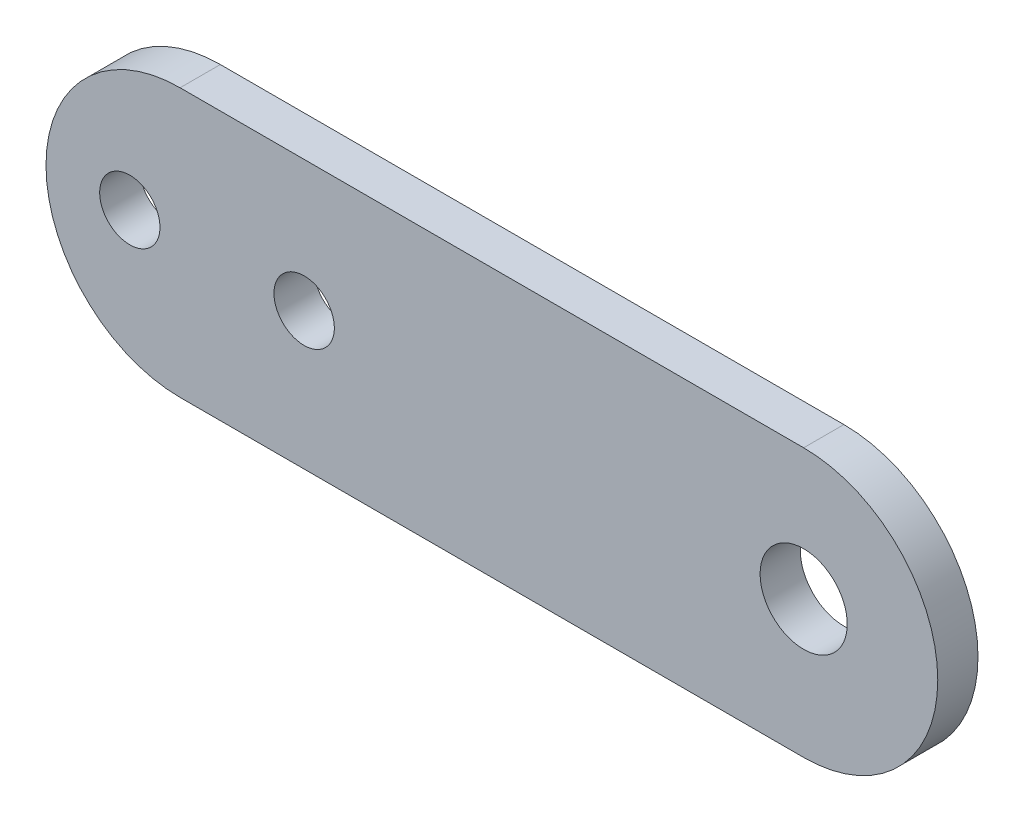
from build123d import *

# Parameters (mm, degrees)
SALIENTE_EXTRUIR1_DEPTH = 3
CROQUIS2_R              = 2.25
CROQUIS2_R_2            = 3.25
CORTAR_EXTRUIR1_DEPTH   = 3


with BuildPart() as part:
    # Croquis1 → Saliente-Extruir1 (new body)
    with BuildSketch(Plane.XY):
        with BuildLine():
            Line((-23.25, 9.768613172), (23.25, 9.768613172))
            ThreePointArc((23.25, 9.768613172), (33.25, -0.231386828), (23.25, -10.231386828))
            Line((23.25, -10.231386828), (-23.25, -10.231386828))
            ThreePointArc((-23.25, -10.231386828), (-33.25, -0.231386828), (-23.25, 9.768613172))
        make_face()
    extrude(amount=SALIENTE_EXTRUIR1_DEPTH)

    # Croquis2 → Cortar-Extruir1 (cut)
    with BuildSketch(Plane(origin=(0, 0, 0), x_dir=(-1, 0, 0), z_dir=(0, 0, -1))):
        with Locations((14, 0)):
            Circle(CROQUIS2_R)
        with Locations((27, 0)):
            Circle(CROQUIS2_R)
        with Locations((-23.25, 0)):
            Circle(CROQUIS2_R_2)
    extrude(amount=-CORTAR_EXTRUIR1_DEPTH, mode=Mode.SUBTRACT)


solid = part.part
